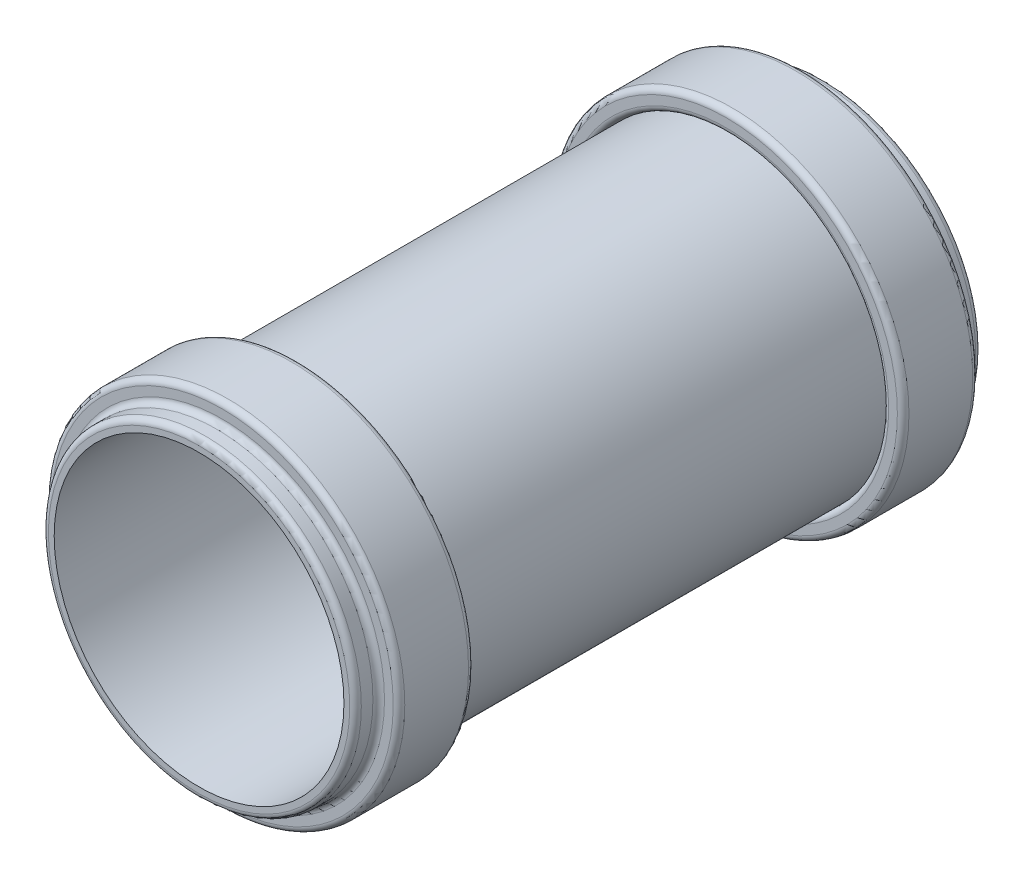
from build123d import *

# Parameters (mm, degrees)
SKETCH_1_R           = 27
SKETCH_1_R_2         = 25
EXTRUDE_1_DEPTH      = 74
SKETCH_2_R           = 30.5
SKETCH_2_R_2         = 27
EXTRUDE_2_DEPTH      = 13
SKETCH_3_R           = 30.5
SKETCH_3_R_2         = 27
EXTRUDE_3_DEPTH      = 13
EXTRUDE_4_DEPTH      = 17
EXTRUDE_4_DEPTH_BACK = 91
SKETCH_4_R           = 27
SKETCH_4_R_2         = 25
FILLET_1_R           = 1
FILLET_2_R           = 1
FILLET_3_R           = 1


with BuildPart() as part:
    # Эскиз1 → Бобышка-Вытянуть1 (new body)
    with BuildSketch(Plane.XY):
        Circle(SKETCH_1_R)
        Circle(SKETCH_1_R_2, mode=Mode.SUBTRACT)
    extrude(amount=EXTRUDE_1_DEPTH)



with BuildPart() as body_2:
    # Эскиз2 → Бобышка-Вытянуть2 (new body)
    with BuildSketch(Plane(origin=(0, 0, 0), x_dir=(-1, 0, 0), z_dir=(0, 0, -1))):
        with Locations(Location((0, 0, 0), (0, 0, 180))):
            Circle(SKETCH_2_R)
        with Locations(Location((0, 0, 0), (0, 0, 180))):
            Circle(SKETCH_2_R_2, mode=Mode.SUBTRACT)
    extrude(amount=EXTRUDE_2_DEPTH)

    # Скругление1
    fillet_1_edges = [body_2.edges().sort_by_distance(p)[0] for p in [
        (-30.5, 0, 0),
        (-30.5, 0, -13),
        (-27, 0, 0),
        (-27, 0, -13),
    ]]
    fillet(fillet_1_edges, radius=FILLET_1_R)


with BuildPart() as body_3:
    # Эскиз3 → Бобышка-Вытянуть3 (new body)
    with BuildSketch(Plane.XY.offset(74)):
        Circle(SKETCH_3_R)
        Circle(SKETCH_3_R_2, mode=Mode.SUBTRACT)
    extrude(amount=EXTRUDE_3_DEPTH)


with BuildPart() as part_1:
    add(part.part)

    add(body_3.part)  # Бобышка-Вытянуть4 merges body 3
    # Эскиз4 → Бобышка-Вытянуть4 (add, two sides: drawn at the far end of the back side and taken through both)
    with BuildSketch(Plane.XY.offset(74).offset(-EXTRUDE_4_DEPTH_BACK)):
        Circle(SKETCH_4_R)
        Circle(SKETCH_4_R_2, mode=Mode.SUBTRACT)
    extrude(amount=EXTRUDE_4_DEPTH + EXTRUDE_4_DEPTH_BACK)

    # Скругление2
    fillet_2_edges = [part_1.edges().sort_by_distance(p)[0] for p in [
        (-27, 0, 74),
        (-30.5, 0, 87),
        (-30.5, 0, 74),
        (-27, 0, 87),
    ]]
    fillet(fillet_2_edges, radius=FILLET_2_R)

    # Скругление3
    fillet_3_edges = [part_1.edges().sort_by_distance(p)[0] for p in [
        (-27, 0, -17),
        (-27, 0, 91),
    ]]
    fillet(fillet_3_edges, radius=FILLET_3_R)


solid = Compound([body_2.part, part_1.part])
